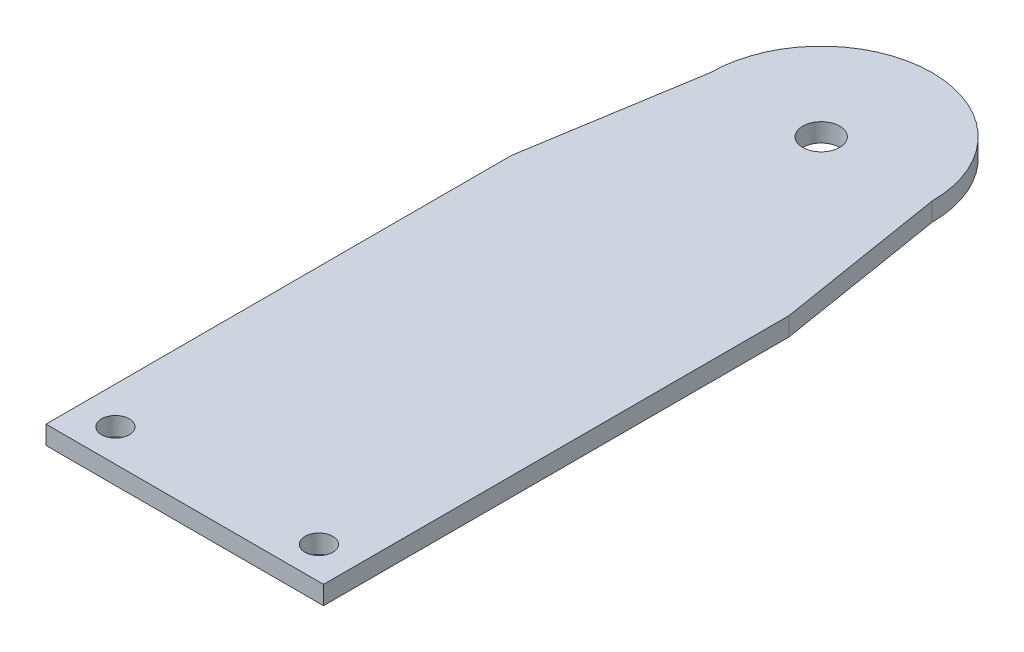
from build123d import *

# Parameters (mm, degrees)
SKETCH_1_R      = 1.5
SKETCH_1_R_2    = 2
EXTRUDE_1_DEPTH = 2


with BuildPart() as part:
    # Эскиз1 → Бобышка-Вытянуть1 (new body)
    with BuildSketch(Plane(origin=(0, 0, 0), x_dir=(1, 0, 0), z_dir=(0, 1, 0))):
        with BuildLine():
            Line((12.374772085, -29.617278809), (12.374772085, 20.682721191))
            Line((12.374772085, 20.682721191), (9.374772085, 39.182721191))
            ThreePointArc((9.374772085, 39.182721191), (-2.625227915, 51.182721191), (-14.625227915, 39.182721191))
            Line((-14.625227915, 39.182721191), (-17.625227915, 20.682721191))
            Line((-17.625227915, 20.682721191), (-17.625227915, -29.617278809))
            Line((-17.625227915, -29.617278809), (-10.625227915, -29.617278809))
            Line((-10.625227915, -29.617278809), (5.374772085, -29.617278809))
            Line((5.374772085, -29.617278809), (12.374772085, -29.617278809))
        make_face()
        with Locations(Location((-13.625227915, -26.117278809, 0), (0, 0, 270))):
            Circle(SKETCH_1_R, mode=Mode.SUBTRACT)
        with Locations(Location((8.374772085, -26.117278809, 0), (0, 0, 270))):
            Circle(SKETCH_1_R, mode=Mode.SUBTRACT)
        with Locations(Location((-2.625227915, 39.182721191, 0), (0, 0, 270))):
            Circle(SKETCH_1_R_2, mode=Mode.SUBTRACT)
    extrude(amount=EXTRUDE_1_DEPTH)


solid = part.part
